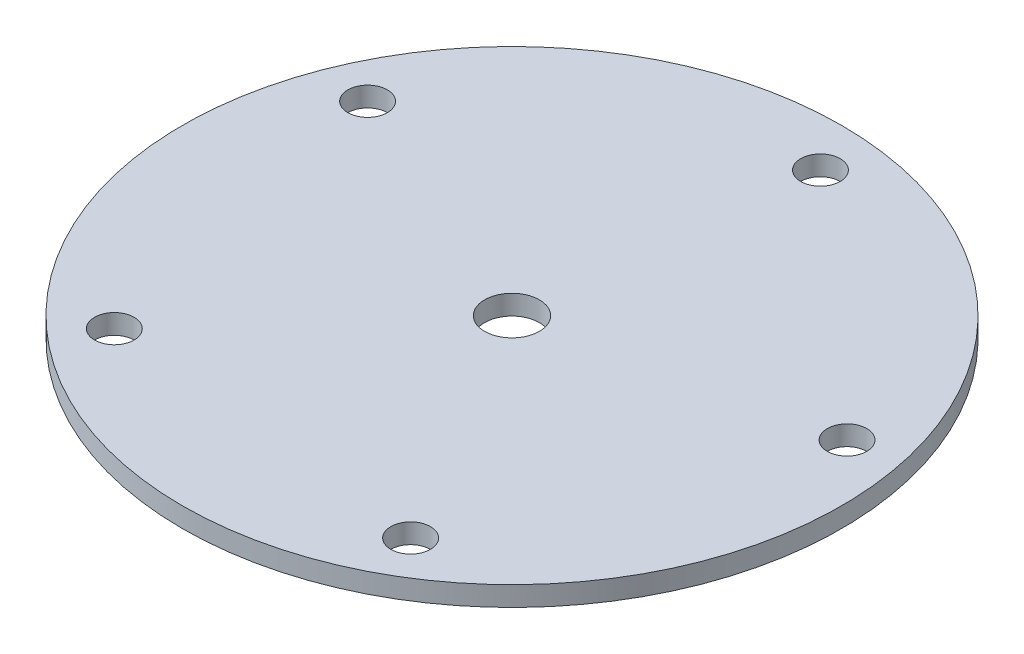
from build123d import *

# Parameters (mm, degrees)
SKETCH1_R           = 50
BOSS_EXTRUDE1_DEPTH = 3
SKETCH2_R           = 4.15
CUT_EXTRUDE1_DEPTH  = 5
SKETCH3_R           = 3
CUT_EXTRUDE2_DEPTH  = 10


with BuildPart() as part:
    # Sketch1 → Boss-Extrude1 (new body)
    with BuildSketch(Plane(origin=(0, 0, 0), x_dir=(1, 0, 0), z_dir=(0, 1, 0))):
        with Locations(Location((0, 0, 0), (0, 0, 270))):
            Circle(SKETCH1_R)
    extrude(amount=BOSS_EXTRUDE1_DEPTH)

    # Sketch2 → Cut-Extrude1 (cut)
    with BuildSketch(Plane(origin=(0, 3, 0), x_dir=(1, 0, 0), z_dir=(0, 1, 0))):
        with Locations(Location((0, 0, 0), (0, 0, 270))):
            Circle(SKETCH2_R)
    extrude(amount=-CUT_EXTRUDE1_DEPTH, mode=Mode.SUBTRACT)

    # Sketch3 → Cut-Extrude2 (cut)
    with BuildSketch(Plane(origin=(0, 3, 0), x_dir=(1, 0, 0), z_dir=(0, 1, 0))):
        with Locations(Location((-28.451614764, -31.883278826, 0), (0, 0, 270))):
            Circle(SKETCH3_R)
        with Locations(Location((-39.114832567, 17.206618627, 0), (0, 0, 270))):
            Circle(SKETCH3_R)
        with Locations(Location((4.277318773, 42.517553969, 0), (0, 0, 270))):
            Circle(SKETCH3_R)
        with Locations(Location((41.75836095, 9.070674844, 0), (0, 0, 270))):
            Circle(SKETCH3_R)
        with Locations(Location((21.530767608, -36.911568614, 0), (0, 0, 270))):
            Circle(SKETCH3_R)
    extrude(amount=-CUT_EXTRUDE2_DEPTH, mode=Mode.SUBTRACT)


solid = part.part
